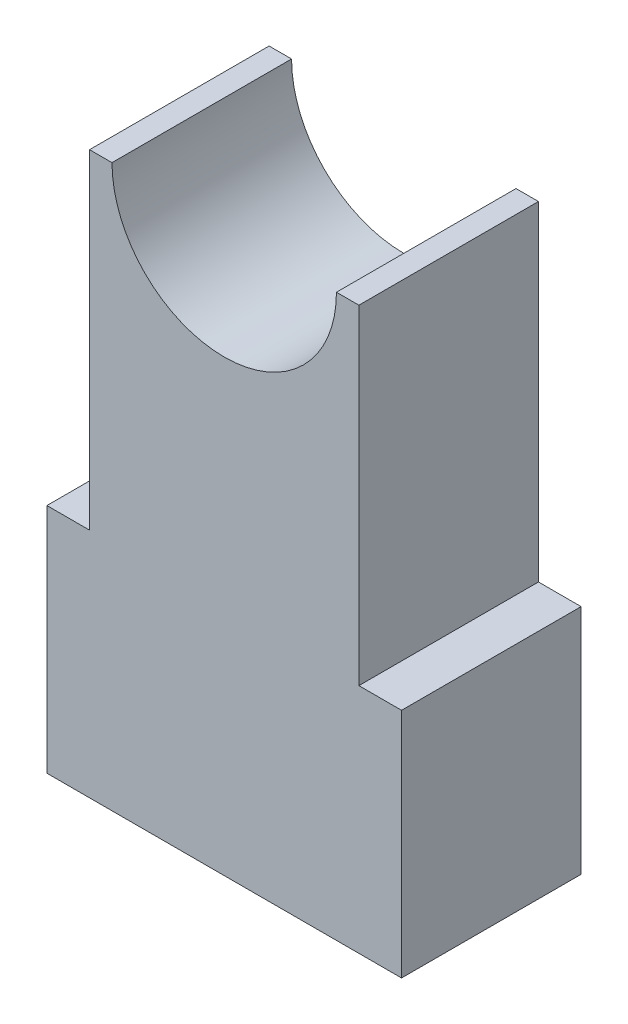
from build123d import *

# Parameters (mm, degrees)
ESQUISSE1_W                  = 15.8
ESQUISSE1_H                  = 8
BOSS_EXTRU_1_DEPTH           = 25.01
ESQUISSE2_R                  = 2.4
ENL_V_MAT_EXTRU_1_DEPTH      = 1.7
ESQUISSE3_W                  = 1.9
ESQUISSE3_H                  = 8
ENL_V_MAT_EXTRU_2_DEPTH      = 14.68
CONG_1_R                     = 0.2
ENL_V_MAT_EXTRU_4_DEPTH      = 31.645392802
ENL_V_MAT_EXTRU_4_DEPTH_BACK = 31.645392802


with BuildPart() as part:
    # Esquisse1 → Boss.-Extru.1 (new body)
    with BuildSketch(Plane(origin=(0, 0, 0), x_dir=(1, 0, 0), z_dir=(0, 1, 0))):
        with Locations((7.9, 4)):
            Rectangle(ESQUISSE1_W, ESQUISSE1_H)
    extrude(amount=BOSS_EXTRU_1_DEPTH)

    # Esquisse2 → Enlèv. mat.-Extru.1 (cut)
    with BuildSketch(Plane.XZ):
        with Locations(Location((3.95, -4, 0), (0, 0, 270))):
            Circle(ESQUISSE2_R)
        with Locations(Location((11.85, -4, 0), (0, 0, 270))):
            Circle(ESQUISSE2_R)
    extrude(amount=-ENL_V_MAT_EXTRU_1_DEPTH, mode=Mode.SUBTRACT)

    # Esquisse3 → Enlèv. mat.-Extru.2 (cut)
    with BuildSketch(Plane(origin=(0, 25.01, 0), x_dir=(1, 0, 0), z_dir=(0, 1, 0))):
        with Locations((0.95, 4)):
            Rectangle(ESQUISSE3_W, ESQUISSE3_H)
        with Locations((14.85, 4)):
            Rectangle(ESQUISSE3_W, ESQUISSE3_H)
    extrude(amount=-ENL_V_MAT_EXTRU_2_DEPTH, mode=Mode.SUBTRACT)

    # Congé1
    cong_1_edges = [part.edges().sort_by_distance(p)[0] for p in [
        (3.95, 1.7, -1.6),
        (11.85, 1.7, -1.6),
    ]]
    fillet(cong_1_edges, radius=CONG_1_R)

    # Esquisse5 → Enlèv. mat.-Extru.4 (cut, two sides: drawn at the far end of the back side and taken through both)
    with BuildSketch(Plane.XY.offset(-ENL_V_MAT_EXTRU_4_DEPTH_BACK)):
        with BuildLine():
            Line((2.9, 91.29179457), (2.9, 25.01))
            ThreePointArc((2.9, 25.01), (7.9, 20.01), (12.9, 25.01))
            Line((12.9, 25.01), (12.9, 91.29179457))
            Line((12.9, 91.29179457), (12.9, 223.855383709))
            Line((12.9, 223.855383709), (2.9, 223.855383709))
            Line((2.9, 223.855383709), (2.9, 91.29179457))
        make_face()
    extrude(amount=ENL_V_MAT_EXTRU_4_DEPTH + ENL_V_MAT_EXTRU_4_DEPTH_BACK, mode=Mode.SUBTRACT)


solid = part.part
